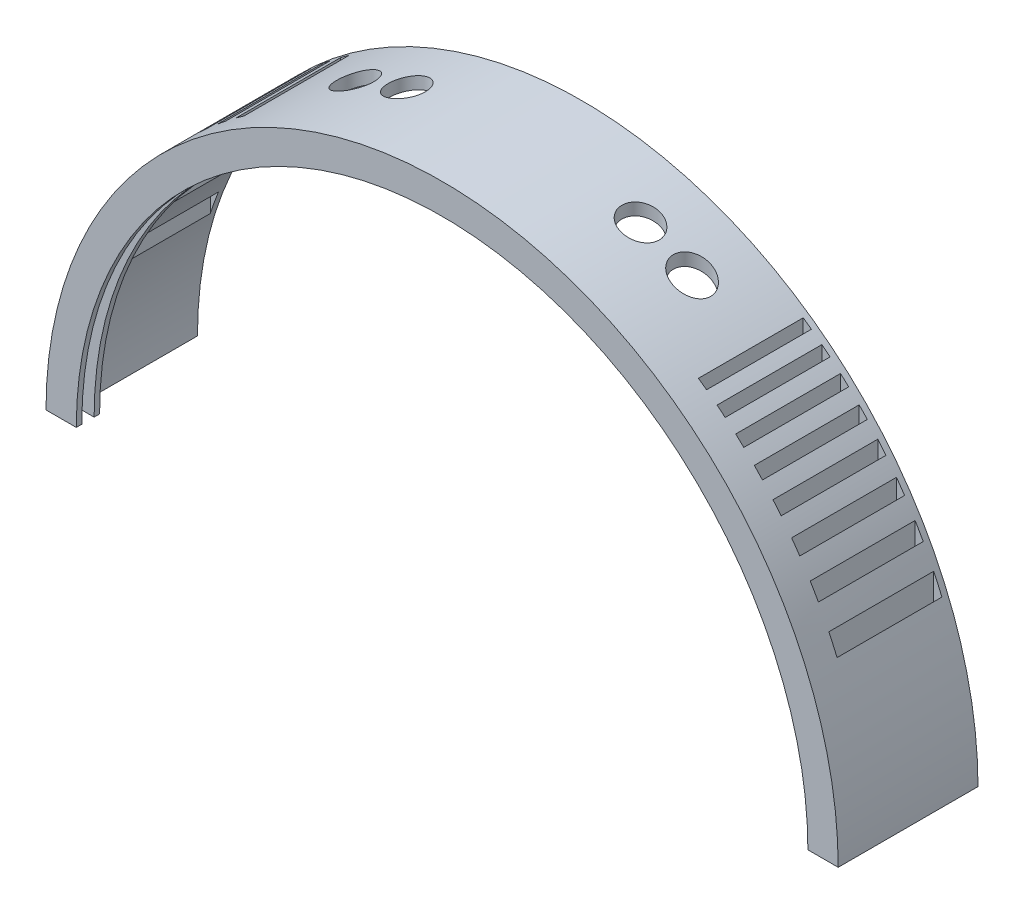
from build123d import *

# Parameters (mm, degrees)
BOSS_EXTRU_1_DEPTH      = 50
ESQUISSE2_W             = 3.5
ESQUISSE2_H             = 45
ENL_V_MAT_EXTRU_1_DEPTH = 1500
ESQUISSE3_R             = 8
ENL_V_MAT_EXTRU_3_DEPTH = 1500
BOSS_EXTRU_2_DEPTH      = 10
BOSS_EXTRU_4_REACH      = 382.427
ESQUISSE5_W             = 330
ESQUISSE5_H             = 2.35
ESQUISSE8_R             = 157
ENL_V_MAT_EXTRU_4_DEPTH = 94


with BuildPart() as part:
    # Esquisse1 → Boss.-Extru.1 (new body)
    with BuildSketch(Plane.XY):
        with BuildLine():
            Line((-335, 205), (-330, 205))
            ThreePointArc((-330, 205), (-165, 370), (0, 205))
            Line((0, 205), (5, 205))
            ThreePointArc((5, 205), (-165, 375), (-335, 205))
        make_face()
    extrude(amount=BOSS_EXTRU_1_DEPTH)

    # Esquisse2 → Enlèv. mat.-Extru.1 (cut)
    with BuildSketch(Plane.XZ.offset(-205)):
        with Locations((-320.25, 25)):
            Rectangle(ESQUISSE2_W, ESQUISSE2_H)
        with Locations((-312.25, 25)):
            Rectangle(ESQUISSE2_W, ESQUISSE2_H)
        with Locations((-304.25, 25)):
            Rectangle(ESQUISSE2_W, ESQUISSE2_H)
        with Locations((-296.25, 25)):
            Rectangle(ESQUISSE2_W, ESQUISSE2_H)
        with Locations((-288.25, 25)):
            Rectangle(ESQUISSE2_W, ESQUISSE2_H)
        with Locations((-280.25, 25)):
            Rectangle(ESQUISSE2_W, ESQUISSE2_H)
        with Locations((-272.25, 25)):
            Rectangle(ESQUISSE2_W, ESQUISSE2_H)
        with Locations((-264.25, 25)):
            Rectangle(ESQUISSE2_W, ESQUISSE2_H)
        with Locations((-9.75, 25)):
            Rectangle(ESQUISSE2_W, ESQUISSE2_H)
        with Locations((-17.75, 25)):
            Rectangle(ESQUISSE2_W, ESQUISSE2_H)
        with Locations((-25.75, 25)):
            Rectangle(ESQUISSE2_W, ESQUISSE2_H)
        with Locations((-33.75, 25)):
            Rectangle(ESQUISSE2_W, ESQUISSE2_H)
        with Locations((-41.75, 25)):
            Rectangle(ESQUISSE2_W, ESQUISSE2_H)
        with Locations((-49.75, 25)):
            Rectangle(ESQUISSE2_W, ESQUISSE2_H)
        with Locations((-57.75, 25)):
            Rectangle(ESQUISSE2_W, ESQUISSE2_H)
        with Locations((-65.75, 25)):
            Rectangle(ESQUISSE2_W, ESQUISSE2_H)
    extrude(amount=-ENL_V_MAT_EXTRU_1_DEPTH, mode=Mode.SUBTRACT)

    # Esquisse3 → Enlèv. mat.-Extru.3 (cut)
    with BuildSketch(Plane.XZ.offset(-205)):
        with Locations(Location((-92.71665832, 25, 0), (0, 0, 270))):
            Circle(ESQUISSE3_R)
        with Locations(Location((-114.83665832, 25, 0), (0, 0, 270))):
            Circle(ESQUISSE3_R)
        with Locations(Location((-237.28334168, 25, 0), (0, 0, 270))):
            Circle(ESQUISSE3_R)
        with Locations(Location((-215.16334168, 25, 0), (0, 0, 270))):
            Circle(ESQUISSE3_R)
    extrude(amount=-ENL_V_MAT_EXTRU_3_DEPTH, mode=Mode.SUBTRACT)

    # Esquisse4 → Boss.-Extru.2 (add)
    with BuildSketch(Plane.XY.offset(50)):
        with BuildLine():
            Line((0, 205), (5, 205))
            ThreePointArc((5, 205), (-44.791847198, 325.208152802), (-165, 375))
            ThreePointArc((-165, 375), (-285.208152802, 325.208152802), (-335, 205))
            Line((-335, 205), (-330, 205))
            ThreePointArc((-330, 205), (-281.672618896, 321.672618896), (-165, 370))
            ThreePointArc((-165, 370), (-48.327381104, 321.672618896), (0, 205))
        make_face()
    extrude(amount=BOSS_EXTRU_2_DEPTH)

    # Esquisse5 → Boss.-Extru.4 (add, up to next)
    with BuildSketch(Plane(origin=(0, 205, 0), x_dir=(-1, 0, 0), z_dir=(0, -1, 0)), mode=Mode.PRIVATE) as boss_extru_4_sk1:
        with Locations((165, -58.825)):
            Rectangle(ESQUISSE5_W, ESQUISSE5_H)
    boss_extru_4_tool1 = extrude(boss_extru_4_sk1.sketch, amount=-BOSS_EXTRU_4_REACH, mode=Mode.PRIVATE) - part.part
    # Esquisse5 → Boss.-Extru.4 (add, up to next)
    with BuildSketch(Plane(origin=(0, 205, 0), x_dir=(-1, 0, 0), z_dir=(0, -1, 0)), mode=Mode.PRIVATE) as boss_extru_4_sk2:
        with Locations((165, -51.175)):
            Rectangle(ESQUISSE5_W, ESQUISSE5_H)
    boss_extru_4_tool2 = extrude(boss_extru_4_sk2.sketch, amount=-BOSS_EXTRU_4_REACH, mode=Mode.PRIVATE) - part.part
    add(boss_extru_4_tool1.solids().sort_by_distance((-165, 205, 58.825))[0])
    add(boss_extru_4_tool2.solids().sort_by_distance((-165, 205, 51.175))[0])

    # Esquisse8 → Enlèv. mat.-Extru.4 (cut)
    with BuildSketch(Plane.XY.offset(60)):
        with Locations((-165, 205)):
            Circle(ESQUISSE8_R)
    extrude(amount=-ENL_V_MAT_EXTRU_4_DEPTH, mode=Mode.SUBTRACT)


solid = part.part
